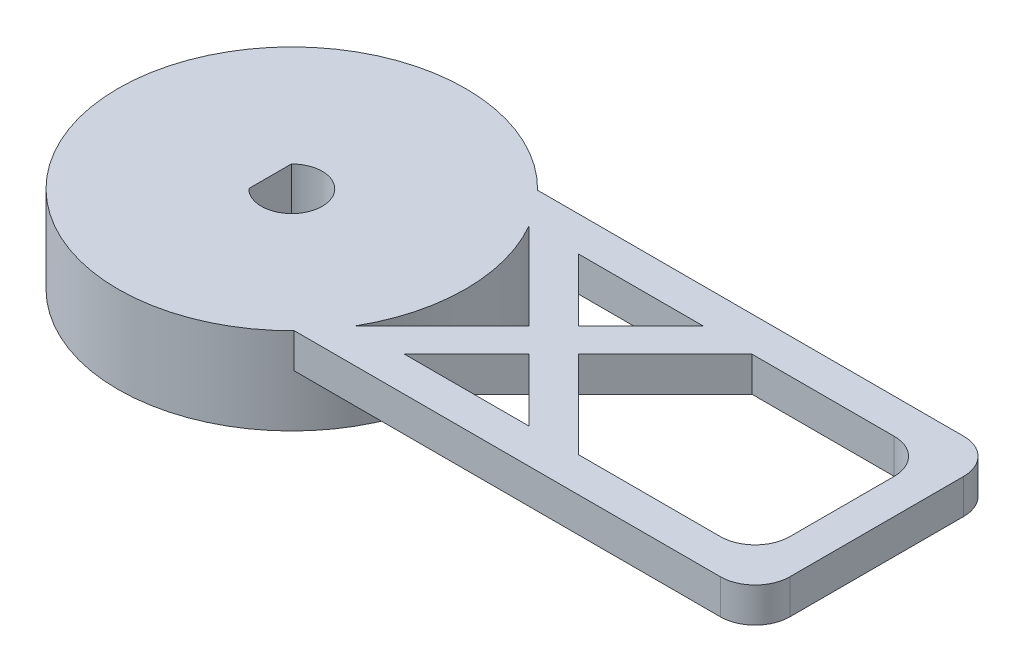
from build123d import *

# Parameters (mm, degrees)
SKETCH1_R           = 10
BOSS_EXTRUDE1_DEPTH = 5
BOSS_EXTRUDE2_DEPTH = 2
BOSS_EXTRUDE3_REACH = 39.189
SKETCH3_W           = 2
SKETCH3_H           = 2
BOSS_EXTRUDE5_DEPTH = 2
FILLET1_R           = 2


with BuildPart() as part:
    # Sketch1 → Boss-Extrude1 (new body)
    with BuildSketch(Plane(origin=(0, 0, 0), x_dir=(1, 0, 0), z_dir=(0, 1, 0))):
        with Locations(Location((0, 0, 0), (0, 0, 270))):
            Circle(SKETCH1_R)
        with BuildLine():
            Line((-1.25, -1.224744871), (-1.25, 1.224744871))
            ThreePointArc((-1.25, 1.224744871), (1.75, 0), (-1.25, -1.224744871))
        make_face(mode=Mode.SUBTRACT)
    extrude(amount=BOSS_EXTRUDE1_DEPTH)

    # Sketch2 → Boss-Extrude2 (add)
    with BuildSketch(Plane(origin=(0, 5, 0), x_dir=(1, 0, 0), z_dir=(0, 1, 0))):
        Polygon((8.660254038, 5), (33.660254038, 5), (33.660254038, 7), (7.141428429, 7), align=None)
        Polygon((7.141428429, -7), (33.660254038, -7), (33.660254038, -5), (8.660254038, -5), align=None)
    extrude(amount=-BOSS_EXTRUDE2_DEPTH)

    # Sketch3 → Boss-Extrude3 (add, up to next)
    with BuildSketch(Plane(origin=(0, 0, 5), x_dir=(-1, 0, 0), z_dir=(0, 0, -1)), mode=Mode.PRIVATE) as boss_extrude3_sk1:
        with Locations((-32.660254038, 4)):
            Rectangle(SKETCH3_W, SKETCH3_H)
    boss_extrude3_tool1 = extrude(boss_extrude3_sk1.sketch, amount=BOSS_EXTRUDE3_REACH, mode=Mode.PRIVATE) - part.part
    add(boss_extrude3_tool1.solids().sort_by_distance((32.660254, 4, 5))[0])

    # Sketch4 → Boss-Extrude5 (add)
    with BuildSketch(Plane(origin=(0, 5, 0), x_dir=(1, 0, 0), z_dir=(0, 1, 0))):
        Polygon((11.488681163, -5), (15.0744676, -1.414213562), (18.660254038, -5), (21.488681163, -5), (16.488681163, 0), (21.488681163, 5), (18.660254038, 5), (15.0744676, 1.414213562), (11.488681163, 5), (8.660254038, 5), (13.660254038, 0), (8.660254038, -5), align=None)
    extrude(amount=-BOSS_EXTRUDE5_DEPTH)

    # Fillet1
    fillet1_edges = [part.edges().sort_by_distance(p)[0] for p in [
        (33.660254038, 4, -7),
        (33.660254038, 4, 7),
        (31.660254038, 4, -5),
        (31.660254038, 4, 5),
    ]]
    fillet(fillet1_edges, radius=FILLET1_R)


solid = part.part
